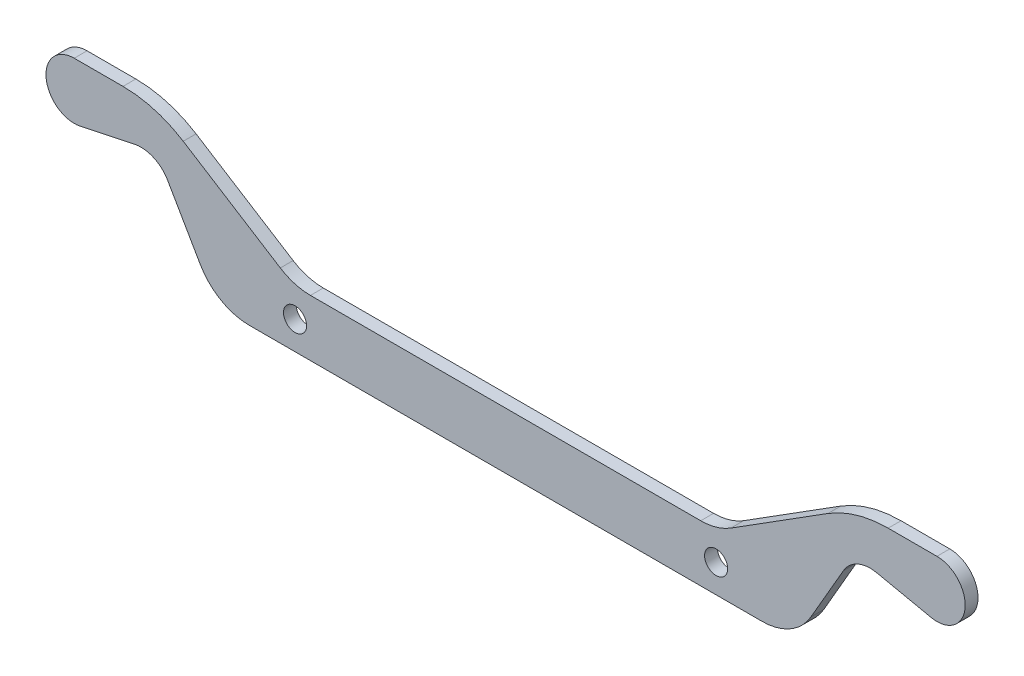
from build123d import *

# Parameters (mm, degrees)
SKETCH1_R           = 2.25
BOSS_EXTRUDE1_DEPTH = 2.5


with BuildPart() as part:
    # Sketch1 → Boss-Extrude1 (new body)
    with BuildSketch(Plane.XY):
        with BuildLine():
            Line((0, 0), (-49.926715175, 0))
            ThreePointArc((-49.926715175, 0), (-55.426715175, 1.473720558), (-59.452994616, 5.5))
            Line((-59.452994616, 5.5), (-65.803847577, 16.5))
            ThreePointArc((-65.803847577, 16.5), (-68.558161164, 18.980640756), (-72.244431158, 19.369530739))
            Line((-72.244431158, 19.369530739), (-82.856553967, 17.119596823))
            ThreePointArc((-82.856553967, 17.119596823), (-89.467301609, 21.926509579), (-83.997282528, 28))
            Line((-83.997282528, 28), (-74.5, 28))
            ThreePointArc((-74.5, 28), (-68.39391207, 27.135649746), (-62.767624018, 24.61051729))
            Line((-62.767624018, 24.61051729), (-43.866187991, 12.694741355))
            ThreePointArc((-43.866187991, 12.694741355), (-41.053043965, 11.432175127), (-38, 11))
            Line((-38, 11), (0, 11))
            Line((0, 11), (0, 0))
        make_face()
        with Locations((-41, 5.5)):
            Circle(SKETCH1_R, mode=Mode.SUBTRACT)
    extrude(amount=BOSS_EXTRUDE1_DEPTH)

    # Mirror1: part across plane


with BuildPart() as part_1:
    add(part.part)
    add(part.part.mirror(Plane(origin=(0, 0, 2.5), x_dir=(0, 0, 1), z_dir=(-1, 0, 0))))


solid = part_1.part
